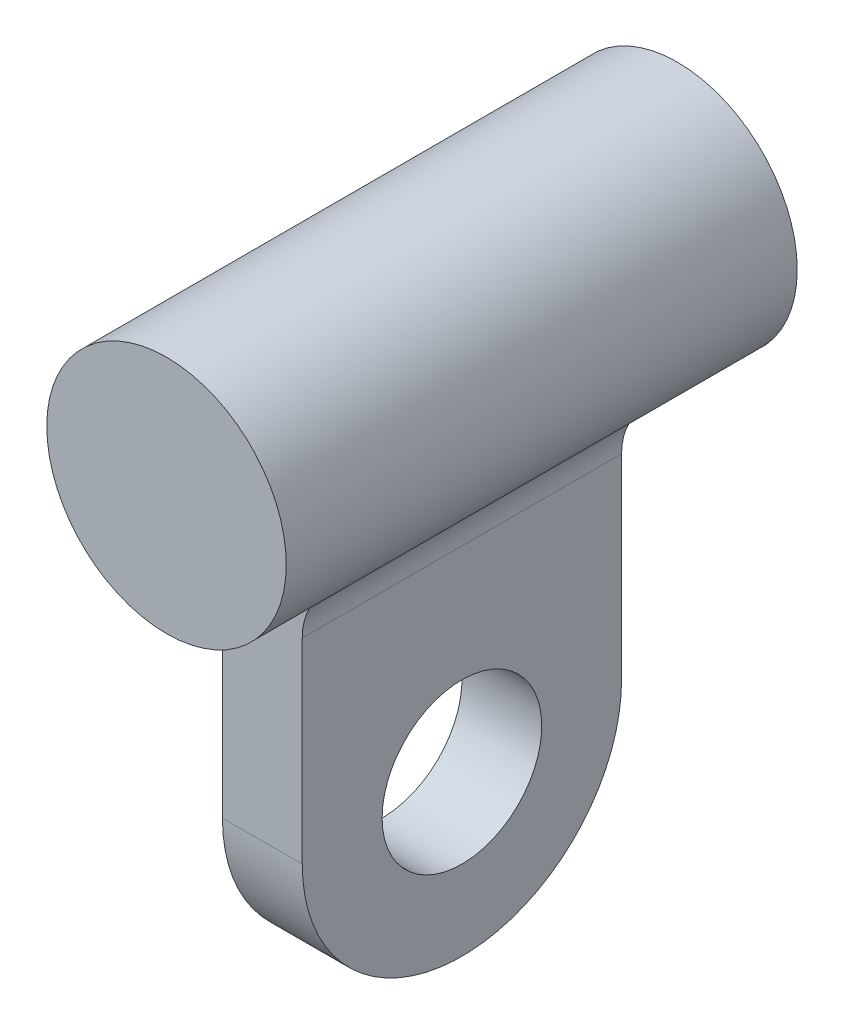
from build123d import *

# Parameters (mm, degrees)
SKETCH1_R           = 4.7625
BOSS_EXTRUDE1_DEPTH = 20.32
SKETCH2_W           = 3.175
SKETCH2_H           = 12.7
BOSS_EXTRUDE2_DEPTH = 19.05
CUT_EXTRUDE1_DEPTH  = 37.015654929
SKETCH4_R           = 3.175
CUT_EXTRUDE2_DEPTH  = 37.015654929
FILLET1_R           = 2.54


with BuildPart() as part:
    # Sketch1 → Boss-Extrude1 (new body)
    with BuildSketch(Plane.XY):
        with Locations((-80.781588965, -8.89)):
            Circle(SKETCH1_R)
    extrude(amount=BOSS_EXTRUDE1_DEPTH)

    # Sketch2 → Boss-Extrude2 (add)
    with BuildSketch(Plane(origin=(0, -10, 0), x_dir=(1, 0, 0), z_dir=(0, 1, 0))):
        with Locations((-80.781588965, -10.16)):
            Rectangle(SKETCH2_W, SKETCH2_H)
    extrude(amount=-BOSS_EXTRUDE2_DEPTH)

    # Sketch3 → Cut-Extrude1 (cut, through all)
    with BuildSketch(Plane.ZY.offset(82.369088965)):
        with BuildLine():
            ThreePointArc((16.51, -22.7), (14.650128061, -27.190128061), (10.16, -29.05))
            Line((10.16, -29.05), (16.51, -29.05))
            Line((16.51, -29.05), (16.51, -22.7))
        make_face()
        with BuildLine():
            ThreePointArc((10.16, -29.05), (5.669871939, -27.190128061), (3.81, -22.7))
            Line((3.81, -22.7), (3.81, -29.05))
            Line((3.81, -29.05), (10.16, -29.05))
        make_face()
    extrude(amount=-CUT_EXTRUDE1_DEPTH, mode=Mode.SUBTRACT)

    # Sketch4 → Cut-Extrude2 (cut, through all)
    with BuildSketch(Plane.ZY.offset(82.369088965)):
        with Locations((10.16, -22.7)):
            Circle(SKETCH4_R)
    extrude(amount=-CUT_EXTRUDE2_DEPTH, mode=Mode.SUBTRACT)

    # Fillet1
    fillet1_edges = [part.edges().sort_by_distance(p)[0] for p in [
        (-82.369088965, -13.380128061, 10.16),
        (-79.194088965, -13.380128061, 10.16),
    ]]
    fillet(fillet1_edges, radius=FILLET1_R)


solid = part.part
